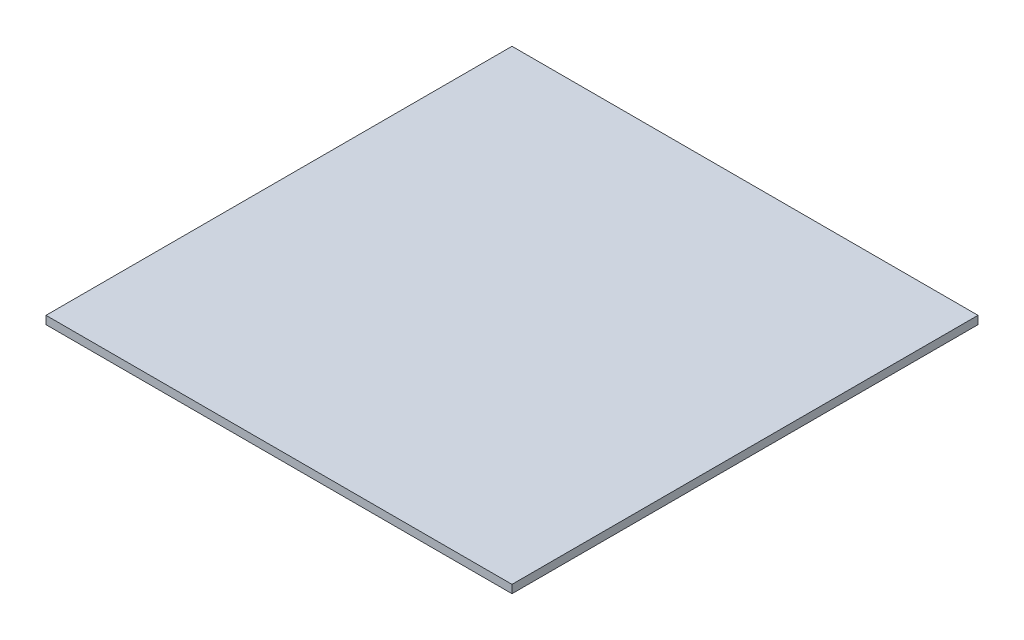
from build123d import *

# Parameters (mm, degrees)
SKETCH1_W           = 8600
SKETCH1_H           = 8600
BOSS_EXTRUDE1_DEPTH = 150


with BuildPart() as part:
    # Sketch1 → Boss-Extrude1 (new body)
    with BuildSketch(Plane(origin=(0, 0, 0), x_dir=(1, 0, 0), z_dir=(0, 1, 0))):
        Rectangle(SKETCH1_W, SKETCH1_H)
    extrude(amount=BOSS_EXTRUDE1_DEPTH)


solid = part.part
